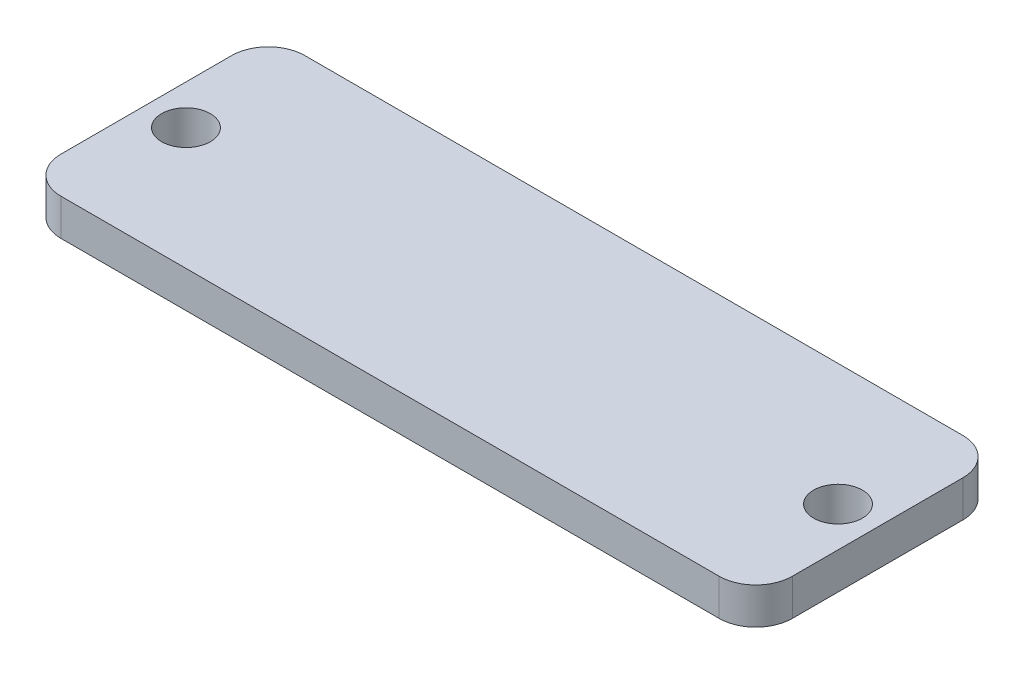
from build123d import *

# Parameters (mm, degrees)
SKETCH_1_W          = 60
SKETCH_1_H          = 20
EXTRUDE_1_DEPTH     = 3
FILLET_1_R          = 3
SKETCH_2_R          = 2
CUT_EXTRUDE_1_DEPTH = 3


with BuildPart() as part:
    # Эскиз1 → Бобышка-Вытянуть1 (new body)
    with BuildSketch(Plane(origin=(0, 0, 0), x_dir=(1, 0, 0), z_dir=(0, 1, 0))):
        Rectangle(SKETCH_1_W, SKETCH_1_H)
    extrude(amount=EXTRUDE_1_DEPTH)

    # Скругление1
    fillet_1_edges = [part.edges().sort_by_distance(p)[0] for p in [
        (30, 1.5, 10),
        (-30, 1.5, 10),
        (-30, 1.5, -10),
        (30, 1.5, -10),
    ]]
    fillet(fillet_1_edges, radius=FILLET_1_R)

    # Эскиз2 → Вырез-Вытянуть1 (cut)
    with BuildSketch(Plane(origin=(0, 3, 0), x_dir=(1, 0, 0), z_dir=(0, 1, 0))):
        with Locations(Location((26.75, 0, 0), (0, 0, 270))):
            Circle(SKETCH_2_R)
        with Locations(Location((-26.75, 0, 0), (0, 0, 90))):
            Circle(SKETCH_2_R)
    extrude(amount=-CUT_EXTRUDE_1_DEPTH, mode=Mode.SUBTRACT)


solid = part.part
